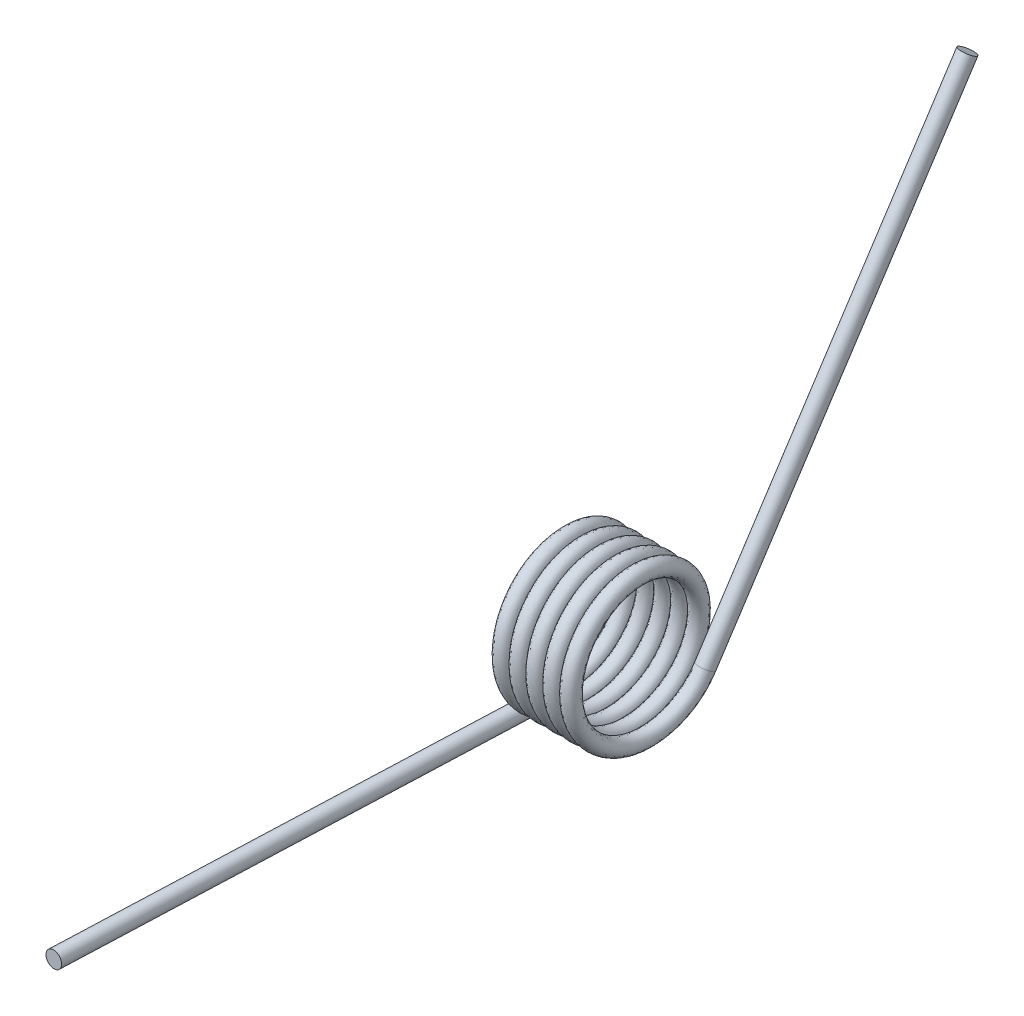
from build123d import *

# Parameters (mm, degrees)
SWEEP1_PITCH       = 0.6604
SWEEP1_HEIGHT      = 3.412066667
SWEEP1_RADIUS      = 2.667
SWEEP1_START_ANGLE = 90
SKETCH3_R          = 0.3175
SKETCH4_R          = 0.3175
EXTRUDE1_DEPTH     = 19.05
SKETCH5_R          = 0.3175
EXTRUDE2_DEPTH     = 19.05


with BuildPart() as part:
    # Sweep1: sweep along a helix
    with BuildLine() as sweep1_path:
        add(Helix(SWEEP1_PITCH, SWEEP1_HEIGHT, SWEEP1_RADIUS, center=(0, 0, 0), direction=(1, 0, 0), mode=Mode.PRIVATE).rotate(Axis((0, 0, 0), (1, 0, 0)), SWEEP1_START_ANGLE))
    # Sketch3 → Sweep1 (sweep)
    with BuildSketch(Plane(origin=(0, -2.667, 0), x_dir=(0.9989545515538123, -0.023236129092748616, 0.0393685945228793), z_dir=(0.03937922672886973, 9.914703606728192e-15, -0.9992243374249029))):
        Circle(SKETCH3_R)
    sweep(path=sweep1_path.line, is_frenet=True)

    # Sketch4 → Extrude1 (add)
    with BuildSketch(Plane(origin=(0, 0, 0), x_dir=(-0.9989545515538123, 0.023236129092748647, -0.039368594522879316), z_dir=(-0.039379226728869746, -9.914812026945441e-15, 0.9992243374249029))):
        with Locations(Location((-0.061970756, 2.666279923, 0), (0, 0, 1.33145196))):
            Circle(SKETCH4_R)
    extrude(amount=EXTRUDE1_DEPTH)

    # Sketch5 → Extrude2 (add)
    with BuildSketch(Plane(origin=(0.005291172, 0.116272852, -0.067130163), x_dir=(0.9981766996120582, -0.05695762474307546, -0.019977620859501895), z_dir=(0.03937922672886974, 0.8653536602896932, -0.49961216871235903))):
        with Locations(Location((3.527940543, 2.508120737, 0), (0, 0, 177.376085598))):
            Circle(SKETCH5_R)
    extrude(amount=EXTRUDE2_DEPTH)


solid = part.part
